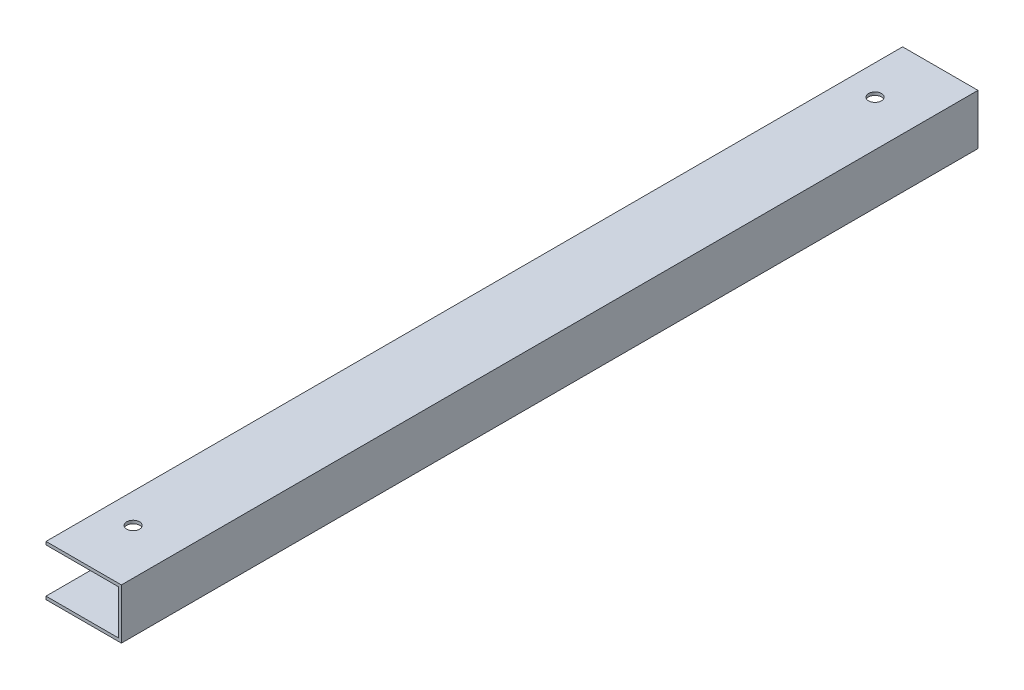
from build123d import *

# Parameters (mm, degrees)
CROQUIS2_W              = 76.2
CROQUIS2_H              = 51
SALIENTE_EXTRUIR1_DEPTH = 433
CROQUIS6_W              = 70
CROQUIS6_H              = 44.8
CORTAR_EXTRUIR1_DEPTH   = 900
CROQUIS7_W              = 866
CROQUIS7_H              = 44.8
CORTAR_EXTRUIR2_DEPTH   = 20
CROQUIS8_R              = 6.5
CORTAR_EXTRUIR3_DEPTH   = 80


with BuildPart() as part:
    # Croquis2 → Saliente-Extruir1 (new, symmetric)
    with BuildSketch(Plane.XY):
        Rectangle(CROQUIS2_W, CROQUIS2_H)
    extrude(amount=SALIENTE_EXTRUIR1_DEPTH, both=True)

    # Croquis6 → Cortar-Extruir1 (cut)
    with BuildSketch(Plane.XY.offset(433)):
        Rectangle(CROQUIS6_W, CROQUIS6_H)
    extrude(amount=-CORTAR_EXTRUIR1_DEPTH, mode=Mode.SUBTRACT)

    # Croquis7 → Cortar-Extruir2 (cut)
    with BuildSketch(Plane.ZY.offset(38.1)):
        Rectangle(CROQUIS7_W, CROQUIS7_H)
    extrude(amount=-CORTAR_EXTRUIR2_DEPTH, mode=Mode.SUBTRACT)

    # Croquis8 → Cortar-Extruir3 (cut)
    with BuildSketch(Plane(origin=(0, 25.5, 0), x_dir=(1, 0, 0), z_dir=(0, 1, 0))):
        with Locations(Location((-8, 375, 0), (0, 0, 180))):
            Circle(CROQUIS8_R)
        with Locations(Location((-8, -375, 0), (0, 0, 180))):
            Circle(CROQUIS8_R)
    extrude(amount=-CORTAR_EXTRUIR3_DEPTH, mode=Mode.SUBTRACT)


solid = part.part
